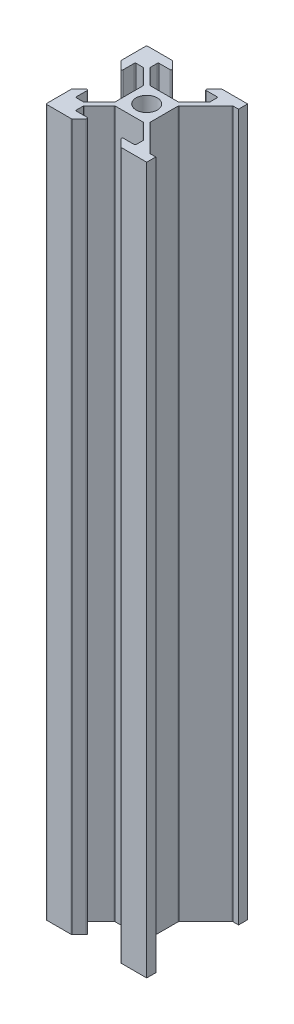
from build123d import *

# Parameters (mm, degrees)
EXTRUDE_1_DEPTH          = 140
FILLET_1_R               = 0.2
CUT_EXTRUDE_1_DEPTH      = 149.996644258
CUT_EXTRUDE_1_DEPTH_BACK = 149.996644258
SKETCH_2_W               = 41.416635457
SKETCH_2_H               = 21.85529521


with BuildPart() as part:
    # 草图1 → 凸台-拉伸1 (new body)
    with BuildSketch(Plane(origin=(0, 0, 0), x_dir=(1, 0, 0), z_dir=(0, 1, 0))):
        with BuildLine():
            Line((-3.476396103, 2.84), (-3.476396103, 0))
            Line((-3.476396103, 0), (-2.1, 0))
            ThreePointArc((-2.1, 0), (-1.48492424, 1.48492424), (0, 2.1))
            Line((0, 2.1), (0, 3.476396103))
            Line((0, 3.476396103), (-2.84, 3.476396103))
            Line((-2.84, 3.476396103), (-5.923603897, 6.56))
            Line((-5.923603897, 6.56), (-5.923603897, 8.2))
            Line((-5.923603897, 8.2), (-3.1, 8.2))
            Line((-3.1, 8.2), (-4.9, 10))
            Line((-4.9, 10), (-10, 10))
            Line((-10, 10), (-10, 4.9))
            Line((-10, 4.9), (-8.2, 3.1))
            Line((-8.2, 3.1), (-8.2, 5.923603897))
            Line((-8.2, 5.923603897), (-6.56, 5.923603897))
            Line((-6.56, 5.923603897), (-3.476396103, 2.84))
        make_face()
        with BuildLine():
            Line((-2.1, 0), (-3.476396103, 0))
            Line((-3.476396103, 0), (-3.476396103, -2.84))
            Line((-3.476396103, -2.84), (-6.56, -5.923603897))
            Line((-6.56, -5.923603897), (-8.2, -5.923603897))
            Line((-8.2, -5.923603897), (-8.2, -3.1))
            Line((-8.2, -3.1), (-10, -4.9))
            Line((-10, -4.9), (-10, -10))
            Line((-10, -10), (-4.9, -10))
            Line((-4.9, -10), (-3.1, -8.2))
            Line((-3.1, -8.2), (-5.923603897, -8.2))
            Line((-5.923603897, -8.2), (-5.923603897, -6.56))
            Line((-5.923603897, -6.56), (-2.84, -3.476396103))
            Line((-2.84, -3.476396103), (0, -3.476396103))
            Line((0, -3.476396103), (0, -2.1))
            ThreePointArc((0, -2.1), (-1.48492424, -1.48492424), (-2.1, 0))
        make_face()
        with BuildLine():
            ThreePointArc((2.1, 0), (1.48492424, -1.48492424), (0, -2.1))
            Line((0, -2.1), (0, -3.476396103))
            Line((0, -3.476396103), (2.84, -3.476396103))
            Line((2.84, -3.476396103), (5.923603897, -6.56))
            Line((5.923603897, -6.56), (5.923603897, -8.2))
            Line((5.923603897, -8.2), (3.1, -8.2))
            Line((3.1, -8.2), (4.9, -10))
            Line((4.9, -10), (15.1, -10))
            Line((15.1, -10), (16.9, -8.2))
            Line((16.9, -8.2), (14.076396103, -8.2))
            Line((14.076396103, -8.2), (14.076396103, -6.56))
            Line((14.076396103, -6.56), (17.16, -3.476396103))
            Line((17.16, -3.476396103), (20, -3.476396103))
            Line((20, -3.476396103), (20, -2.1))
            ThreePointArc((20, -2.1), (18.51507576, -1.48492424), (17.9, 0))
            Line((17.9, 0), (16.523603897, 0))
            Line((16.523603897, 0), (16.523603897, -2.84))
            Line((16.523603897, -2.84), (13.44, -5.923603897))
            Line((13.44, -5.923603897), (11.163603897, -8.2))
            Line((11.163603897, -8.2), (8.836396103, -8.2))
            Line((8.836396103, -8.2), (6.56, -5.923603897))
            Line((6.56, -5.923603897), (3.476396103, -2.84))
            Line((3.476396103, -2.84), (3.476396103, 0))
            Line((3.476396103, 0), (2.1, 0))
        make_face()
        with BuildLine():
            Line((0, 3.476396103), (0, 2.1))
            ThreePointArc((0, 2.1), (1.48492424, 1.48492424), (2.1, 0))
            Line((2.1, 0), (3.476396103, 0))
            Line((3.476396103, 0), (3.476396103, 2.84))
            Line((3.476396103, 2.84), (6.56, 5.923603897))
            Line((6.56, 5.923603897), (8.836396103, 8.2))
            Line((8.836396103, 8.2), (11.163603897, 8.2))
            Line((11.163603897, 8.2), (13.44, 5.923603897))
            Line((13.44, 5.923603897), (16.523603897, 2.84))
            Line((16.523603897, 2.84), (16.523603897, 0))
            Line((16.523603897, 0), (17.9, 0))
            ThreePointArc((17.9, 0), (18.51507576, 1.48492424), (20, 2.1))
            Line((20, 2.1), (20, 3.476396103))
            Line((20, 3.476396103), (17.16, 3.476396103))
            Line((17.16, 3.476396103), (14.076396103, 6.56))
            Line((14.076396103, 6.56), (14.076396103, 8.2))
            Line((14.076396103, 8.2), (16.9, 8.2))
            Line((16.9, 8.2), (15.1, 10))
            Line((15.1, 10), (4.9, 10))
            Line((4.9, 10), (3.1, 8.2))
            Line((3.1, 8.2), (5.923603897, 8.2))
            Line((5.923603897, 8.2), (5.923603897, 6.56))
            Line((5.923603897, 6.56), (2.84, 3.476396103))
            Line((2.84, 3.476396103), (0, 3.476396103))
        make_face()
        with BuildLine():
            Line((20, 3.476396103), (20, 2.1))
            ThreePointArc((20, 2.1), (21.48492424, 1.48492424), (22.1, 0))
            Line((22.1, 0), (23.476396103, 0))
            Line((23.476396103, 0), (23.476396103, 2.84))
            Line((23.476396103, 2.84), (26.56, 5.923603897))
            Line((26.56, 5.923603897), (28.836396103, 8.2))
            Line((28.836396103, 8.2), (31.163603897, 8.2))
            Line((31.163603897, 8.2), (33.44, 5.923603897))
            Line((33.44, 5.923603897), (36.523603897, 2.84))
            Line((36.523603897, 2.84), (36.523603897, 0))
            Line((36.523603897, 0), (37.9, 0))
            ThreePointArc((37.9, 0), (40, 2.1), (42.1, 0))
            Line((42.1, 0), (43.476396103, 0))
            Line((43.476396103, 0), (43.476396103, 2.84))
            Line((43.476396103, 2.84), (46.56, 5.923603897))
            Line((46.56, 5.923603897), (48.2, 5.923603897))
            Line((48.2, 5.923603897), (48.2, 3.1))
            Line((48.2, 3.1), (50, 4.9))
            Line((50, 4.9), (50, 10))
            Line((50, 10), (44.9, 10))
            Line((44.9, 10), (43.1, 8.2))
            Line((43.1, 8.2), (45.923603897, 8.2))
            Line((45.923603897, 8.2), (45.923603897, 6.56))
            Line((45.923603897, 6.56), (42.84, 3.476396103))
            Line((42.84, 3.476396103), (37.16, 3.476396103))
            Line((37.16, 3.476396103), (34.076396103, 6.56))
            Line((34.076396103, 6.56), (34.076396103, 8.2))
            Line((34.076396103, 8.2), (36.9, 8.2))
            Line((36.9, 8.2), (35.1, 10))
            Line((35.1, 10), (24.9, 10))
            Line((24.9, 10), (23.1, 8.2))
            Line((23.1, 8.2), (25.923603897, 8.2))
            Line((25.923603897, 8.2), (25.923603897, 6.56))
            Line((25.923603897, 6.56), (22.84, 3.476396103))
            Line((22.84, 3.476396103), (20, 3.476396103))
        make_face()
        with BuildLine():
            ThreePointArc((22.1, 0), (21.48492424, -1.48492424), (20, -2.1))
            Line((20, -2.1), (20, -3.476396103))
            Line((20, -3.476396103), (22.84, -3.476396103))
            Line((22.84, -3.476396103), (25.923603897, -6.56))
            Line((25.923603897, -6.56), (25.923603897, -8.2))
            Line((25.923603897, -8.2), (23.1, -8.2))
            Line((23.1, -8.2), (24.9, -10))
            Line((24.9, -10), (35.1, -10))
            Line((35.1, -10), (36.9, -8.2))
            Line((36.9, -8.2), (34.076396103, -8.2))
            Line((34.076396103, -8.2), (34.076396103, -6.56))
            Line((34.076396103, -6.56), (37.16, -3.476396103))
            Line((37.16, -3.476396103), (42.84, -3.476396103))
            Line((42.84, -3.476396103), (45.923603897, -6.56))
            Line((45.923603897, -6.56), (45.923603897, -8.2))
            Line((45.923603897, -8.2), (43.1, -8.2))
            Line((43.1, -8.2), (44.9, -10))
            Line((44.9, -10), (50, -10))
            Line((50, -10), (50, -4.9))
            Line((50, -4.9), (48.2, -3.1))
            Line((48.2, -3.1), (48.2, -5.923603897))
            Line((48.2, -5.923603897), (46.56, -5.923603897))
            Line((46.56, -5.923603897), (43.476396103, -2.84))
            Line((43.476396103, -2.84), (43.476396103, 0))
            Line((43.476396103, 0), (42.1, 0))
            ThreePointArc((42.1, 0), (40, -2.1), (37.9, 0))
            Line((37.9, 0), (36.523603897, 0))
            Line((36.523603897, 0), (36.523603897, -2.84))
            Line((36.523603897, -2.84), (33.44, -5.923603897))
            Line((33.44, -5.923603897), (31.163603897, -8.2))
            Line((31.163603897, -8.2), (28.836396103, -8.2))
            Line((28.836396103, -8.2), (26.56, -5.923603897))
            Line((26.56, -5.923603897), (23.476396103, -2.84))
            Line((23.476396103, -2.84), (23.476396103, 0))
            Line((23.476396103, 0), (22.1, 0))
        make_face()
    extrude(amount=EXTRUDE_1_DEPTH)

    # 圆角1
    fillet_1_edges = [part.edges().sort_by_distance(p)[0] for p in [
        (8.836396103, 70, 8.2),
        (11.163603897, 70, 8.2),
        (16.523603897, 70, 2.84),
        (16.523603897, 70, -2.84),
        (11.163603897, 70, -8.2),
        (8.836396103, 70, -8.2),
        (3.476396103, 70, -2.84),
        (3.476396103, 70, 2.84),
        (28.836396103, 70, 8.2),
        (31.163603897, 70, 8.2),
        (36.523603897, 70, 2.84),
        (36.523603897, 70, -2.84),
        (31.163603897, 70, -8.2),
        (28.836396103, 70, -8.2),
        (23.476396103, 70, -2.84),
        (23.476396103, 70, 2.84),
        (46.56, 70, 5.923603897),
        (48.2, 70, 5.923603897),
        (48.2, 70, 3.1),
        (50, 70, 4.9),
        (50, 70, 10),
        (44.9, 70, 10),
        (43.1, 70, 8.2),
        (45.923603897, 70, 8.2),
        (45.923603897, 70, 6.56),
        (42.84, 70, 3.476396103),
        (37.16, 70, 3.476396103),
        (34.076396103, 70, 6.56),
        (34.076396103, 70, 8.2),
        (36.9, 70, 8.2),
        (35.1, 70, 10),
        (24.9, 70, 10),
        (23.1, 70, 8.2),
        (25.923603897, 70, 8.2),
        (25.923603897, 70, 6.56),
        (22.84, 70, 3.476396103),
        (17.16, 70, 3.476396103),
        (14.076396103, 70, 6.56),
        (14.076396103, 70, 8.2),
        (16.9, 70, 8.2),
        (15.1, 70, 10),
        (4.9, 70, 10),
        (3.1, 70, 8.2),
        (5.923603897, 70, 8.2),
        (5.923603897, 70, 6.56),
        (2.84, 70, 3.476396103),
        (-2.84, 70, 3.476396103),
        (-5.923603897, 70, 6.56),
        (-5.923603897, 70, 8.2),
        (-3.1, 70, 8.2),
        (-4.9, 70, 10),
        (-10, 70, 10),
        (-10, 70, 4.9),
        (-8.2, 70, 3.1),
        (-8.2, 70, 5.923603897),
        (-6.56, 70, 5.923603897),
        (-3.476396103, 70, 2.84),
        (-3.476396103, 70, -2.84),
        (-6.56, 70, -5.923603897),
        (-8.2, 70, -5.923603897),
        (-8.2, 70, -3.1),
        (-10, 70, -4.9),
        (-10, 70, -10),
        (-4.9, 70, -10),
        (-3.1, 70, -8.2),
        (-5.923603897, 70, -8.2),
        (-5.923603897, 70, -6.56),
        (-2.84, 70, -3.476396103),
        (2.84, 70, -3.476396103),
        (5.923603897, 70, -6.56),
        (5.923603897, 70, -8.2),
        (3.1, 70, -8.2),
        (4.9, 70, -10),
        (15.1, 70, -10),
        (16.9, 70, -8.2),
        (14.076396103, 70, -8.2),
        (14.076396103, 70, -6.56),
        (17.16, 70, -3.476396103),
        (22.84, 70, -3.476396103),
        (25.923603897, 70, -6.56),
        (25.923603897, 70, -8.2),
        (23.1, 70, -8.2),
        (24.9, 70, -10),
        (35.1, 70, -10),
        (36.9, 70, -8.2),
        (34.076396103, 70, -8.2),
        (34.076396103, 70, -6.56),
        (37.16, 70, -3.476396103),
        (42.84, 70, -3.476396103),
        (45.923603897, 70, -6.56),
        (45.923603897, 70, -8.2),
        (43.1, 70, -8.2),
        (44.9, 70, -10),
        (50, 70, -10),
        (50, 70, -4.9),
        (48.2, 70, -3.1),
        (48.2, 70, -5.923603897),
        (46.56, 70, -5.923603897),
        (43.476396103, 70, -2.84),
        (43.476396103, 70, 2.84),
    ]]
    fillet(fillet_1_edges, radius=FILLET_1_R)

    # 草图2 → 切除-拉伸1 (cut, two sides: drawn at the far end of the back side and taken through both)
    with BuildSketch(Plane.XZ.offset(-CUT_EXTRUDE_1_DEPTH_BACK)):
        with Locations((30.708317729, -0.927647605)):
            Rectangle(SKETCH_2_W, SKETCH_2_H)
    extrude(amount=CUT_EXTRUDE_1_DEPTH + CUT_EXTRUDE_1_DEPTH_BACK, mode=Mode.SUBTRACT)


solid = part.part
